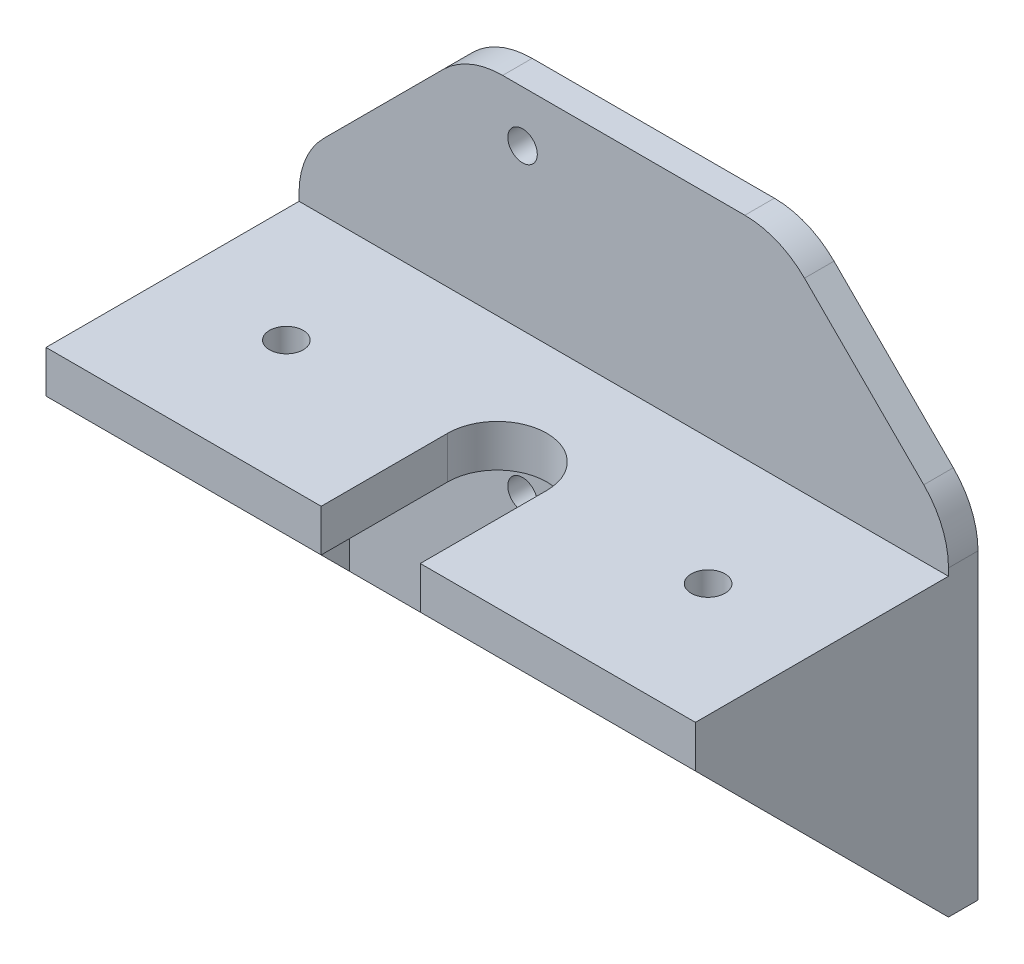
from build123d import *

# Parameters (mm, degrees)
SKETCH1_W           = 77
SKETCH1_H           = 60
SKETCH1_R           = 1.75
BOSS_EXTRUDE1_DEPTH = 3.5
SKETCH2_W           = 77
SKETCH2_H           = 5
BOSS_EXTRUDE2_DEPTH = 30
CUT_EXTRUDE1_DEPTH  = 20
SKETCH4_R           = 2
CUT_EXTRUDE2_DEPTH  = 20
RIB2_REACH          = 95.823
SKETCH5_WALL_W      = 232.071524048
SKETCH5_WALL_H      = 6
CHAMFER1_SIZE       = 20
FILLET1_R           = 10


with BuildPart() as part:
    # Sketch1 → Boss-Extrude1 (new body)
    with BuildSketch(Plane.XY):
        with Locations((-12, 11.85)):
            Rectangle(SKETCH1_W, SKETCH1_H)
        with Locations((-24, 35.8)):
            Circle(SKETCH1_R, mode=Mode.SUBTRACT)
        with Locations((-24, 0)):
            Circle(SKETCH1_R, mode=Mode.SUBTRACT)
        Circle(SKETCH1_R, mode=Mode.SUBTRACT)
    extrude(amount=BOSS_EXTRUDE1_DEPTH)

    # Sketch2 → Boss-Extrude2 (add)
    with BuildSketch(Plane.XY.offset(3.5)):
        with Locations((-12, 14.35)):
            Rectangle(SKETCH2_W, SKETCH2_H)
    extrude(amount=BOSS_EXTRUDE2_DEPTH)

    # Sketch3 → Cut-Extrude1 (cut)
    with BuildSketch(Plane(origin=(0, 16.85, 0), x_dir=(1, 0, 0), z_dir=(0, 1, 0))):
        with BuildLine():
            Line((-17.875, -18.5), (-17.875, -33.5))
            Line((-17.875, -33.5), (-6.125, -33.5))
            Line((-6.125, -33.5), (-6.125, -18.5))
            ThreePointArc((-6.125, -18.5), (-12, -12.625), (-17.875, -18.5))
        make_face()
    extrude(amount=-CUT_EXTRUDE1_DEPTH, mode=Mode.SUBTRACT)

    # Sketch4 → Cut-Extrude2 (cut)
    with BuildSketch(Plane(origin=(0, 16.85, 0), x_dir=(1, 0, 0), z_dir=(0, 1, 0))):
        with Locations(Location((13, -18.5, 0), (0, 0, 270))):
            Circle(SKETCH4_R)
        with Locations(Location((-37, -18.5, 0), (0, 0, 270))):
            Circle(SKETCH4_R)
    extrude(amount=-CUT_EXTRUDE2_DEPTH, mode=Mode.SUBTRACT)

    # Sketch5 wall → Rib2 (add, up to next)
    with BuildSketch(Plane(origin=(26.5, -3.15, 18.5), x_dir=(0, -0.707106781187, -0.707106781187), z_dir=(0, 0.707106781187, -0.707106781187)), mode=Mode.PRIVATE) as rib2_sk1:
        with Locations((0, 3)):
            Rectangle(SKETCH5_WALL_W, SKETCH5_WALL_H)
    rib2_tool1 = extrude(rib2_sk1.sketch, amount=RIB2_REACH, mode=Mode.PRIVATE) - part.part
    rib2 = rib2_tool1.solids().sort_by_distance((26.5, -3.15, 18.5))[0]
    add(rib2)

    # Mirror1: Rib2 across plane
    add(rib2.mirror(Plane(origin=(-12, 0, 0), x_dir=(0, 0, 1), z_dir=(1, 0, 0))))

    # Chamfer1
    chamfer1_edges = [part.edges().sort_by_distance(p)[0] for p in [
        (-50.5, 41.85, 1.75),
        (26.5, 41.85, 1.75),
    ]]
    chamfer(chamfer1_edges, length=CHAMFER1_SIZE)

    # Fillet1
    fillet1_edges = [part.edges().sort_by_distance(p)[0] for p in [
        (-50.5, 21.85, 1.75),
        (-30.5, 41.85, 1.75),
        (26.5, 21.85, 1.75),
        (6.5, 41.85, 1.75),
    ]]
    fillet(fillet1_edges, radius=FILLET1_R)


solid = part.part
